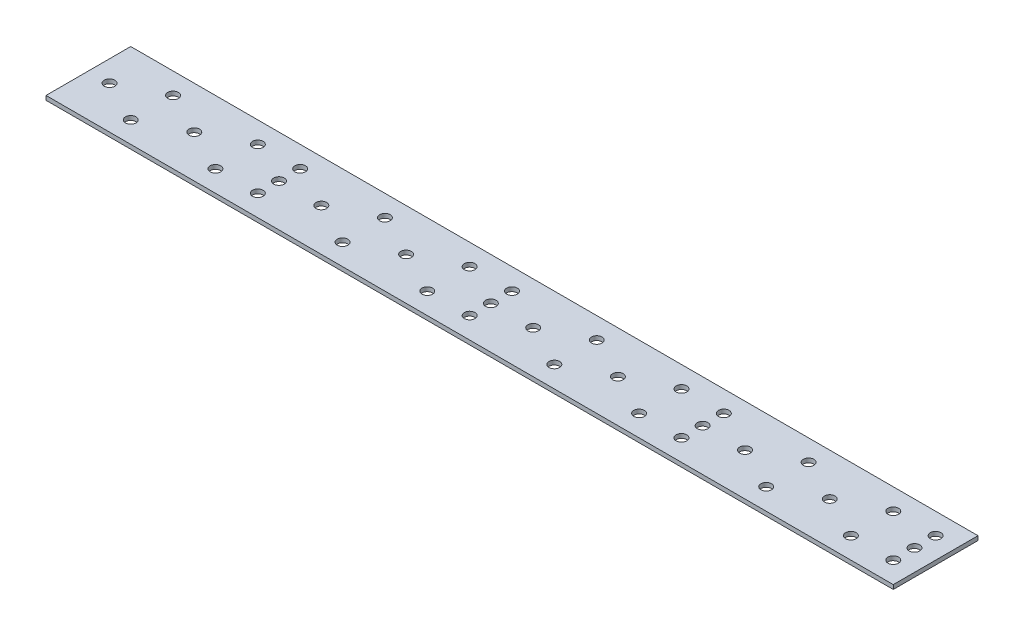
from build123d import *

# Parameters (mm, degrees)
SKETCH_1_W      = 400
SKETCH_1_H      = 40
SKETCH_1_R      = 2.5
EXTRUDE_1_DEPTH = 2


with BuildPart() as part:
    # Эскиз1 → Бобышка-Вытянуть1 (new body)
    with BuildSketch(Plane(origin=(0, 0, 0), x_dir=(1, 0, 0), z_dir=(0, 1, 0))):
        Rectangle(SKETCH_1_W, SKETCH_1_H)
        with Locations(Location((-190, 0, 0), (0, 0, 270))):
            Circle(SKETCH_1_R, mode=Mode.SUBTRACT)
        with Locations(Location((-170, 10, 0), (0, 0, 270))):
            Circle(SKETCH_1_R, mode=Mode.SUBTRACT)
        with Locations(Location((-170, -10, 0), (0, 0, 270))):
            Circle(SKETCH_1_R, mode=Mode.SUBTRACT)
        with Locations(Location((-150, 0, 0), (0, 0, 270))):
            Circle(SKETCH_1_R, mode=Mode.SUBTRACT)
        with Locations(Location((-130, 10, 0), (0, 0, 270))):
            Circle(SKETCH_1_R, mode=Mode.SUBTRACT)
        with Locations(Location((-130, -10, 0), (0, 0, 270))):
            Circle(SKETCH_1_R, mode=Mode.SUBTRACT)
        with Locations(Location((-110, 10, 0), (0, 0, 270))):
            Circle(SKETCH_1_R, mode=Mode.SUBTRACT)
        with Locations(Location((-110, 0, 0), (0, 0, 270))):
            Circle(SKETCH_1_R, mode=Mode.SUBTRACT)
        with Locations(Location((-110, -10, 0), (0, 0, 270))):
            Circle(SKETCH_1_R, mode=Mode.SUBTRACT)
        with Locations(Location((-90, 0, 0), (0, 0, 270))):
            Circle(SKETCH_1_R, mode=Mode.SUBTRACT)
        with Locations(Location((-70, 10, 0), (0, 0, 270))):
            Circle(SKETCH_1_R, mode=Mode.SUBTRACT)
        with Locations(Location((-70, -10, 0), (0, 0, 270))):
            Circle(SKETCH_1_R, mode=Mode.SUBTRACT)
        with Locations(Location((-50, 0, 0), (0, 0, 270))):
            Circle(SKETCH_1_R, mode=Mode.SUBTRACT)
        with Locations(Location((-30, 10, 0), (0, 0, 270))):
            Circle(SKETCH_1_R, mode=Mode.SUBTRACT)
        with Locations(Location((-30, -10, 0), (0, 0, 270))):
            Circle(SKETCH_1_R, mode=Mode.SUBTRACT)
        with Locations(Location((-10, -10, 0), (0, 0, 270))):
            Circle(SKETCH_1_R, mode=Mode.SUBTRACT)
        with Locations(Location((-10, 0, 0), (0, 0, 270))):
            Circle(SKETCH_1_R, mode=Mode.SUBTRACT)
        with Locations(Location((-10, 10, 0), (0, 0, 270))):
            Circle(SKETCH_1_R, mode=Mode.SUBTRACT)
        with Locations(Location((10, 0, 0), (0, 0, 270))):
            Circle(SKETCH_1_R, mode=Mode.SUBTRACT)
        with Locations(Location((30, 10, 0), (0, 0, 270))):
            Circle(SKETCH_1_R, mode=Mode.SUBTRACT)
        with Locations(Location((30, -10, 0), (0, 0, 270))):
            Circle(SKETCH_1_R, mode=Mode.SUBTRACT)
        with Locations(Location((50, 0, 0), (0, 0, 270))):
            Circle(SKETCH_1_R, mode=Mode.SUBTRACT)
        with Locations(Location((70, 10, 0), (0, 0, 270))):
            Circle(SKETCH_1_R, mode=Mode.SUBTRACT)
        with Locations(Location((70, -10, 0), (0, 0, 270))):
            Circle(SKETCH_1_R, mode=Mode.SUBTRACT)
        with Locations(Location((90, -10, 0), (0, 0, 270))):
            Circle(SKETCH_1_R, mode=Mode.SUBTRACT)
        with Locations(Location((90, 0, 0), (0, 0, 270))):
            Circle(SKETCH_1_R, mode=Mode.SUBTRACT)
        with Locations(Location((90, 10, 0), (0, 0, 270))):
            Circle(SKETCH_1_R, mode=Mode.SUBTRACT)
        with Locations(Location((110, 0, 0), (0, 0, 270))):
            Circle(SKETCH_1_R, mode=Mode.SUBTRACT)
        with Locations(Location((130, 10, 0), (0, 0, 270))):
            Circle(SKETCH_1_R, mode=Mode.SUBTRACT)
        with Locations(Location((130, -10, 0), (0, 0, 270))):
            Circle(SKETCH_1_R, mode=Mode.SUBTRACT)
        with Locations(Location((150, 0, 0), (0, 0, 270))):
            Circle(SKETCH_1_R, mode=Mode.SUBTRACT)
        with Locations(Location((170, 10, 0), (0, 0, 270))):
            Circle(SKETCH_1_R, mode=Mode.SUBTRACT)
        with Locations(Location((170, -10, 0), (0, 0, 270))):
            Circle(SKETCH_1_R, mode=Mode.SUBTRACT)
        with Locations(Location((190, -10, 0), (0, 0, 270))):
            Circle(SKETCH_1_R, mode=Mode.SUBTRACT)
        with Locations(Location((190, 0, 0), (0, 0, 270))):
            Circle(SKETCH_1_R, mode=Mode.SUBTRACT)
        with Locations(Location((190, 10, 0), (0, 0, 270))):
            Circle(SKETCH_1_R, mode=Mode.SUBTRACT)
    extrude(amount=EXTRUDE_1_DEPTH)


solid = part.part
